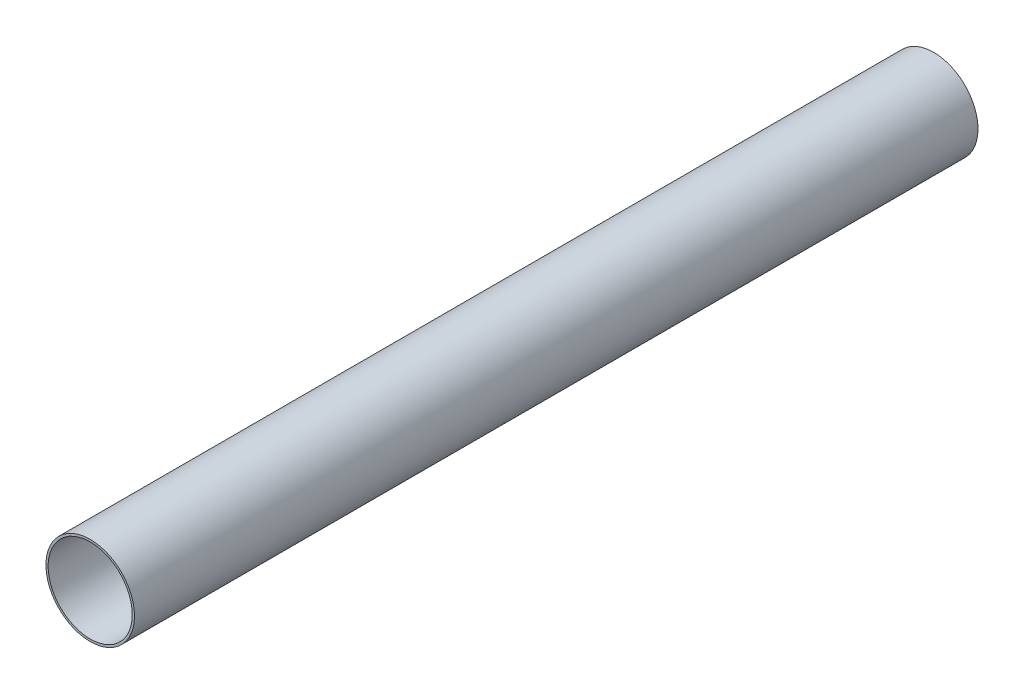
from build123d import *

# Parameters (mm, degrees)
SKETCH_1_R      = 60
SKETCH_1_R_2    = 57
EXTRUDE_1_DEPTH = 1143


with BuildPart() as part:
    # 草图1 → 凸台-拉伸1 (new body)
    with BuildSketch(Plane.XY):
        Circle(SKETCH_1_R)
        Circle(SKETCH_1_R_2, mode=Mode.SUBTRACT)
    extrude(amount=EXTRUDE_1_DEPTH)


solid = part.part
